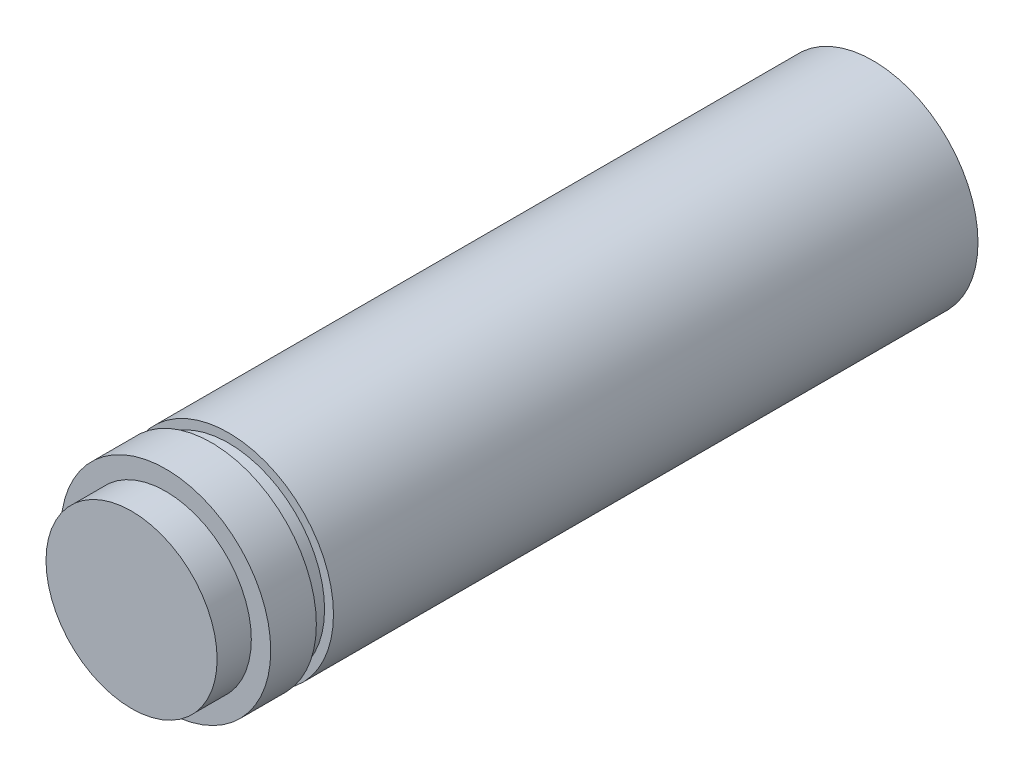
from build123d import *

# Parameters (mm, degrees)
SKETCH1_R           = 9.2
BOSS_EXTRUDE1_DEPTH = 65
CUT_EXTRUDE2_START  = -3
SKETCH2_R           = 9.2
SKETCH2_R_2         = 7.5
CUT_EXTRUDE2_DEPTH  = 3
CUT_EXTRUDE3_START  = -1.5
SKETCH3_R           = 9.2
SKETCH3_R_2         = 8.419577465
CUT_EXTRUDE3_DEPTH  = 1.5


with BuildPart() as part:
    # Sketch1 → Boss-Extrude1 (new body)
    with BuildSketch(Plane.XY):
        Circle(SKETCH1_R)
    extrude(amount=BOSS_EXTRUDE1_DEPTH)

    # Sketch2 → Cut-Extrude2 (cut)
    with BuildSketch(Plane.XY.offset(65).offset(CUT_EXTRUDE2_START)):
        Circle(SKETCH2_R)
        Circle(SKETCH2_R_2, mode=Mode.SUBTRACT)
    extrude(amount=CUT_EXTRUDE2_DEPTH, mode=Mode.SUBTRACT)

    # Sketch3 → Cut-Extrude3 (cut)
    with BuildSketch(Plane.XY.offset(58).offset(CUT_EXTRUDE3_START)):
        Circle(SKETCH3_R)
        Circle(SKETCH3_R_2, mode=Mode.SUBTRACT)
    extrude(amount=CUT_EXTRUDE3_DEPTH, mode=Mode.SUBTRACT)


solid = part.part
